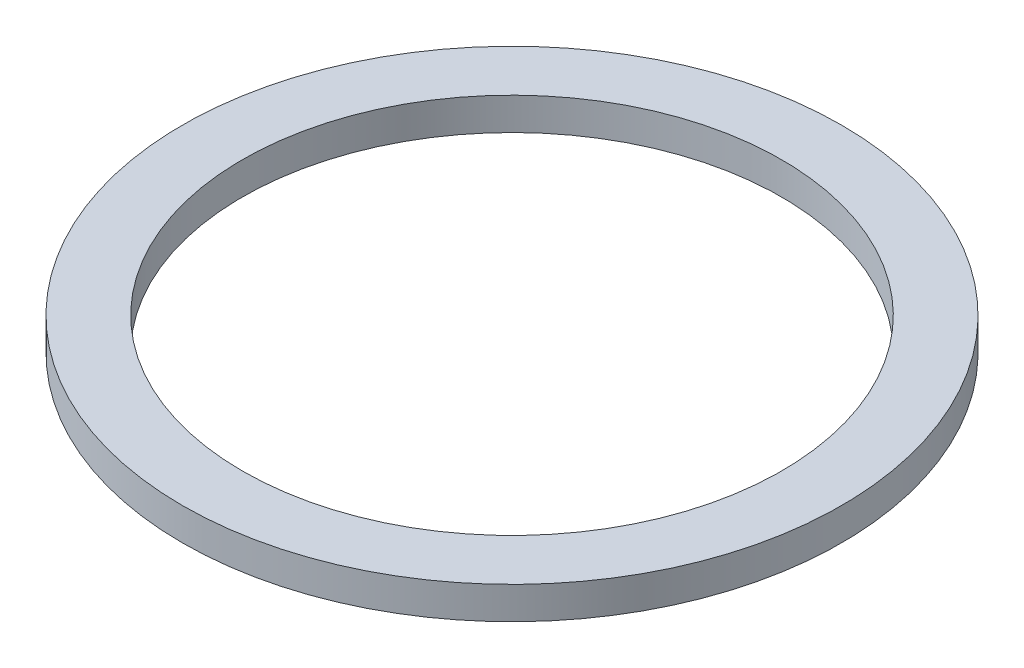
from build123d import *

# Parameters (mm, degrees)
SKETCH1_R           = 16.5
BOSS_EXTRUDE1_DEPTH = 1.62
SKETCH2_R           = 13.5
CUT_EXTRUDE1_DEPTH  = 1.62


with BuildPart() as part:
    # Sketch1 → Boss-Extrude1 (new body)
    with BuildSketch(Plane(origin=(0, 0, 0), x_dir=(1, 0, 0), z_dir=(0, 1, 0))):
        with Locations(Location((0, 0, 0), (0, 0, 270))):
            Circle(SKETCH1_R)
    extrude(amount=BOSS_EXTRUDE1_DEPTH)

    # Sketch2 → Cut-Extrude1 (cut)
    with BuildSketch(Plane(origin=(0, 1.62, 0), x_dir=(1, 0, 0), z_dir=(0, 1, 0))):
        with Locations(Location((0, 0, 0), (0, 0, 270))):
            Circle(SKETCH2_R)
    extrude(amount=-CUT_EXTRUDE1_DEPTH, mode=Mode.SUBTRACT)


solid = part.part
